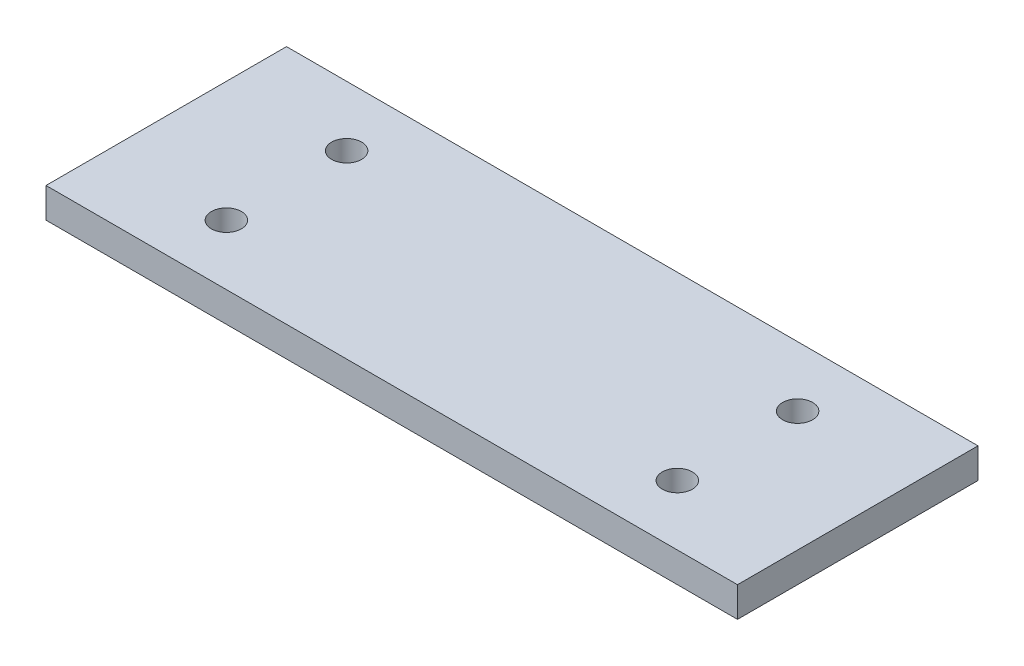
from build123d import *

# Parameters (mm, degrees)
SKETCH1_W           = 115
SKETCH1_H           = 40
SKETCH1_R           = 2.5
BOSS_EXTRUDE1_DEPTH = 5


with BuildPart() as part:
    # Sketch1 → Boss-Extrude1 (new body)
    with BuildSketch(Plane(origin=(0, 0, 0), x_dir=(1, 0, 0), z_dir=(0, 1, 0))):
        with Locations((57.5, 20)):
            Rectangle(SKETCH1_W, SKETCH1_H)
        with Locations(Location((20, 10, 0), (0, 0, 270))):
            Circle(SKETCH1_R, mode=Mode.SUBTRACT)
        with Locations(Location((95, 10, 0), (0, 0, 270))):
            Circle(SKETCH1_R, mode=Mode.SUBTRACT)
        with Locations(Location((95, 30, 0), (0, 0, 270))):
            Circle(SKETCH1_R, mode=Mode.SUBTRACT)
        with Locations(Location((20, 30, 0), (0, 0, 270))):
            Circle(SKETCH1_R, mode=Mode.SUBTRACT)
    extrude(amount=BOSS_EXTRUDE1_DEPTH)


solid = part.part
